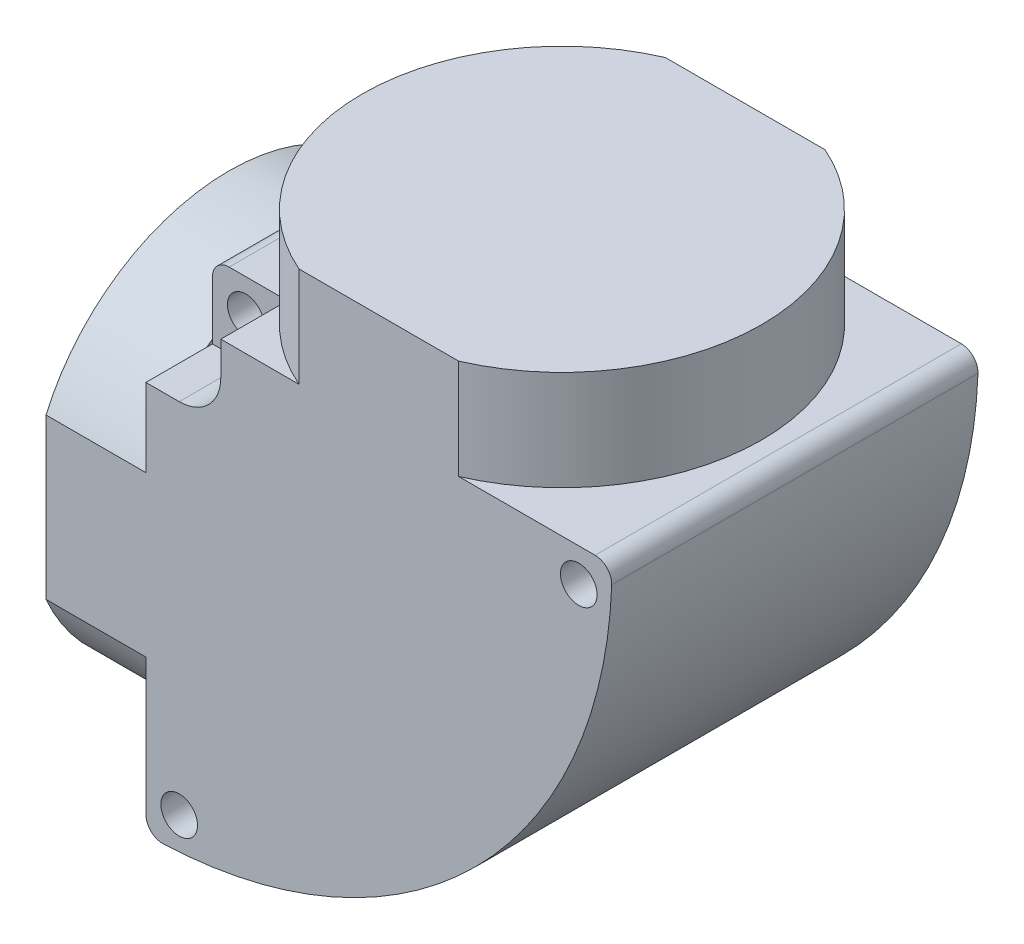
from build123d import *

# Parameters (mm, degrees)
EXTRUDE_1_DEPTH     = 22
SKETCH_2_R          = 1.1
CUT_EXTRUDE_1_DEPTH = 22
CUT_EXTRUDE_2_DEPTH = 4
FILLET_2_R          = 1
EXTRUDE_2_DEPTH     = 6
EXTRUDE_3_DEPTH     = 6


with BuildPart() as part:
    # 草图1 → 凸台-拉伸1 (new body)
    with BuildSketch(Plane.XY):
        with BuildLine():
            Line((0, 0), (28, 0))
            ThreePointArc((28, 0), (19.798989873, -19.798989873), (0, -28))
            Line((0, -28), (0, 0))
        make_face()
    extrude(amount=EXTRUDE_1_DEPTH)

    # 草图2 → 切除-拉伸1 (cut)
    with BuildSketch(Plane.XY.offset(22)):
        with Locations((2, -2)):
            Circle(SKETCH_2_R)
        with Locations((26, -2)):
            Circle(SKETCH_2_R)
        with Locations(Location((2, -26, 0), (0, 0, 180))):
            Circle(SKETCH_2_R)
    extrude(amount=-CUT_EXTRUDE_1_DEPTH, mode=Mode.SUBTRACT)

    # 草图4 → 切除-拉伸2 (cut)
    with BuildSketch(Plane.XY.offset(22)):
        with BuildLine():
            Line((4.5, -2), (4.5, 0.5))
            Line((4.5, 0.5), (-2.867094288, 0.5))
            Line((-2.867094288, 0.5), (-2.867094288, -4.5))
            Line((-2.867094288, -4.5), (2, -4.5))
            ThreePointArc((2, -4.5), (3.767766953, -3.767766953), (4.5, -2))
        make_face()
    extrude(amount=-CUT_EXTRUDE_2_DEPTH, mode=Mode.SUBTRACT)

    # 圆角2
    fillet_2_edges = [part.edges().sort_by_distance(p)[0] for p in [
        (0, 0, 9),
        (28, 0, 11),
        (0, -28, 11),
    ]]
    fillet(fillet_2_edges, radius=FILLET_2_R)

    # 草图5 → 凸台-拉伸2 (add)
    with BuildSketch(Plane.ZY):
        with BuildLine():
            Line((0, -9.19490604), (0, -18.786569087))
            ThreePointArc((0, -18.786569087), (11, -25.990737563), (22, -18.786569087))
            Line((22, -18.786569087), (22, -9.19490604))
            ThreePointArc((22, -9.19490604), (11, -1.990737563), (0, -9.19490604))
        make_face()
    extrude(amount=EXTRUDE_2_DEPTH)

    # 草图6 → 凸台-拉伸3 (add)
    with BuildSketch(Plane(origin=(0, 0, 0), x_dir=(1, 0, 0), z_dir=(0, 1, 0))):
        with BuildLine():
            Line((9.19490604, 0), (18.786569087, 0))
            ThreePointArc((18.786569087, 0), (25.990737563, -11), (18.786569087, -22))
            Line((18.786569087, -22), (9.19490604, -22))
            ThreePointArc((9.19490604, -22), (1.990737563, -11), (9.19490604, 0))
        make_face()
    extrude(amount=EXTRUDE_3_DEPTH)


solid = part.part
